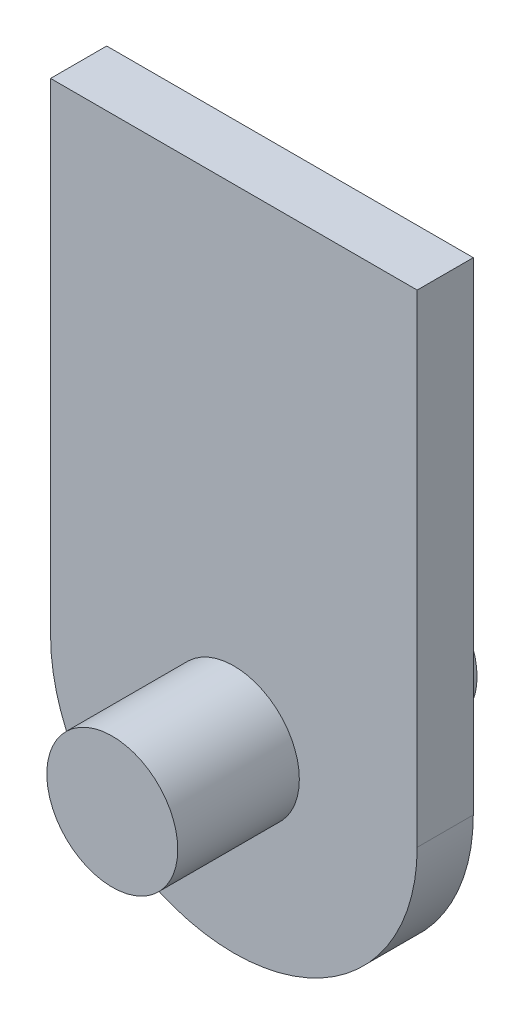
from build123d import *

# Parameters (mm, degrees)
BOSS_EXTRUDE1_DEPTH = 1.190625
SKETCH2_R           = 2.778125
BOSS_EXTRUDE2_DEPTH = 6.35


with BuildPart() as part:
    # Sketch1 → Boss-Extrude1 (new, symmetric)
    with BuildSketch(Plane.XY):
        with BuildLine():
            Line((22.568685476, 13.663463824), (22.568685476, 34.140593758))
            Line((22.568685476, 34.140593758), (7.014425609, 34.140593758))
            Line((7.014425609, 34.140593758), (7.014425609, 13.663463824))
            ThreePointArc((7.014425609, 13.663463824), (14.791555542, 5.886333891), (22.568685476, 13.663463824))
        make_face()
    extrude(amount=BOSS_EXTRUDE1_DEPTH, both=True)

    # Sketch2 → Boss-Extrude2 (add, symmetric)
    with BuildSketch(Plane.XY):
        with Locations((14.791555542, 13.663463824)):
            Circle(SKETCH2_R)
    extrude(amount=BOSS_EXTRUDE2_DEPTH, both=True)


solid = part.part
